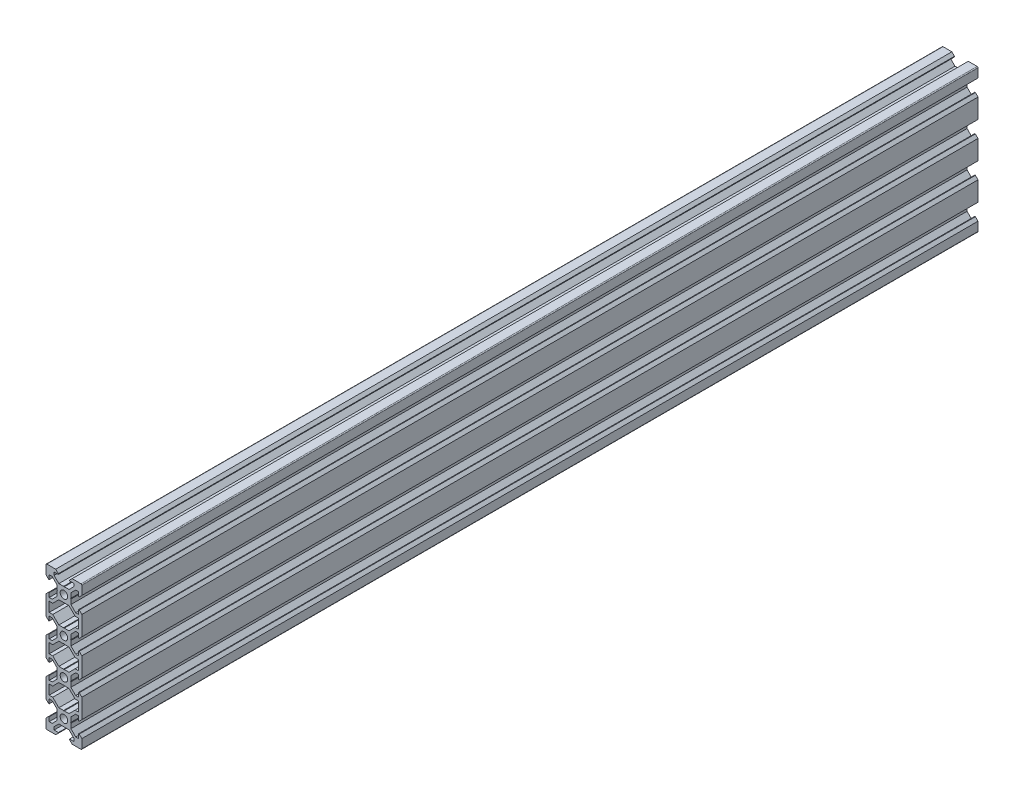
from build123d import *

# Parameters (mm, degrees)
BOSS_EXTRU_1_DEPTH = 500


with BuildPart() as part:
    # Esquisse1 → Boss.-Extru.1 (new body)
    with BuildSketch(Plane.XY):
        with BuildLine():
            Line((-9.5, 10), (-4.58, 10))
            Line((-4.58, 10), (-3.125, 8.545))
            Line((-3.125, 8.545), (-3.125, 8.2))
            Line((-3.125, 8.2), (-5.5, 8.2))
            Line((-5.5, 8.2), (-5.5, 6.560660172))
            Line((-5.5, 6.560660172), (-2.839339828, 3.9))
            Line((-2.839339828, 3.9), (-0.21, 3.9))
            Line((-0.21, 3.9), (0, 3.69))
            Line((0, 3.69), (0, 2.1))
            ThreePointArc((0, 2.1), (-2.1, 0), (0, -2.1))
            Line((0, -2.1), (0, -3.69))
            Line((0, -3.69), (-0.21, -3.9))
            Line((-0.21, -3.9), (-2.839339828, -3.9))
            Line((-2.839339828, -3.9), (-6.239339828, -7.3))
            Line((-6.239339828, -7.3), (-8.2, -7.3))
            Line((-8.2, -7.3), (-8.2, -12.7))
            Line((-8.2, -12.7), (-6.239339828, -12.7))
            Line((-6.239339828, -12.7), (-2.839339828, -16.1))
            Line((-2.839339828, -16.1), (-0.21, -16.1))
            Line((-0.21, -16.1), (0, -16.31))
            Line((0, -16.31), (0, -17.9))
            ThreePointArc((0, -17.9), (-2.1, -20), (0, -22.1))
            Line((0, -22.1), (0, -23.69))
            Line((0, -23.69), (-0.21, -23.9))
            Line((-0.21, -23.9), (-2.839339828, -23.9))
            Line((-2.839339828, -23.9), (-6.239339828, -27.3))
            Line((-6.239339828, -27.3), (-8.2, -27.3))
            Line((-8.2, -27.3), (-8.2, -32.7))
            Line((-8.2, -32.7), (-6.239339828, -32.7))
            Line((-6.239339828, -32.7), (-2.839339828, -36.1))
            Line((-2.839339828, -36.1), (-0.21, -36.1))
            Line((-0.21, -36.1), (0, -36.31))
            Line((0, -36.31), (0, -37.9))
            ThreePointArc((0, -37.9), (-2.1, -40), (0, -42.1))
            Line((0, -42.1), (0, -43.69))
            Line((0, -43.69), (-0.21, -43.9))
            Line((-0.21, -43.9), (-2.839339828, -43.9))
            Line((-2.839339828, -43.9), (-6.239339828, -47.3))
            Line((-6.239339828, -47.3), (-8.2, -47.3))
            Line((-8.2, -47.3), (-8.2, -52.7))
            Line((-8.2, -52.7), (-6.239339828, -52.7))
            Line((-6.239339828, -52.7), (-2.839339828, -56.1))
            Line((-2.839339828, -56.1), (-0.21, -56.1))
            Line((-0.21, -56.1), (0, -56.31))
            Line((0, -56.31), (0, -57.9))
            ThreePointArc((0, -57.9), (-2.1, -60), (0, -62.1))
            Line((0, -62.1), (0, -63.69))
            Line((0, -63.69), (-0.21, -63.9))
            Line((-0.21, -63.9), (-2.839339828, -63.9))
            Line((-2.839339828, -63.9), (-5.5, -66.560660172))
            Line((-5.5, -66.560660172), (-5.5, -68.2))
            Line((-5.5, -68.2), (-3.125, -68.2))
            Line((-3.125, -68.2), (-3.125, -68.545))
            Line((-3.125, -68.545), (-4.58, -70))
            Line((-4.58, -70), (-9.5, -70))
            ThreePointArc((-9.5, -70), (-9.853553391, -69.853553391), (-10, -69.5))
            Line((-10, -69.5), (-10, -64.58))
            Line((-10, -64.58), (-8.545, -63.125))
            Line((-8.545, -63.125), (-8.2, -63.125))
            Line((-8.2, -63.125), (-8.2, -65.5))
            Line((-8.2, -65.5), (-6.560660172, -65.5))
            Line((-6.560660172, -65.5), (-3.9, -62.839339828))
            Line((-3.9, -62.839339828), (-3.9, -60.21))
            Line((-3.9, -60.21), (-3.69, -60))
            Line((-3.69, -60), (-3.9, -59.79))
            Line((-3.9, -59.79), (-3.9, -57.160660172))
            Line((-3.9, -57.160660172), (-6.560660172, -54.5))
            Line((-6.560660172, -54.5), (-8.2, -54.5))
            Line((-8.2, -54.5), (-8.2, -56.875))
            Line((-8.2, -56.875), (-8.545, -56.875))
            Line((-8.545, -56.875), (-10, -55.42))
            Line((-10, -55.42), (-10, -44.58))
            Line((-10, -44.58), (-8.545, -43.125))
            Line((-8.545, -43.125), (-8.2, -43.125))
            Line((-8.2, -43.125), (-8.2, -45.5))
            Line((-8.2, -45.5), (-6.560660172, -45.5))
            Line((-6.560660172, -45.5), (-3.9, -42.839339828))
            Line((-3.9, -42.839339828), (-3.9, -40.21))
            Line((-3.9, -40.21), (-3.69, -40))
            Line((-3.69, -40), (-3.9, -39.79))
            Line((-3.9, -39.79), (-3.9, -37.160660172))
            Line((-3.9, -37.160660172), (-6.560660172, -34.5))
            Line((-6.560660172, -34.5), (-8.2, -34.5))
            Line((-8.2, -34.5), (-8.2, -36.875))
            Line((-8.2, -36.875), (-8.545, -36.875))
            Line((-8.545, -36.875), (-10, -35.42))
            Line((-10, -35.42), (-10, -24.58))
            Line((-10, -24.58), (-8.545, -23.125))
            Line((-8.545, -23.125), (-8.2, -23.125))
            Line((-8.2, -23.125), (-8.2, -25.5))
            Line((-8.2, -25.5), (-6.560660172, -25.5))
            Line((-6.560660172, -25.5), (-3.9, -22.839339828))
            Line((-3.9, -22.839339828), (-3.9, -20.21))
            Line((-3.9, -20.21), (-3.69, -20))
            Line((-3.69, -20), (-3.9, -19.79))
            Line((-3.9, -19.79), (-3.9, -17.160660172))
            Line((-3.9, -17.160660172), (-6.560660172, -14.5))
            Line((-6.560660172, -14.5), (-8.2, -14.5))
            Line((-8.2, -14.5), (-8.2, -16.875))
            Line((-8.2, -16.875), (-8.545, -16.875))
            Line((-8.545, -16.875), (-10, -15.42))
            Line((-10, -15.42), (-10, -4.58))
            Line((-10, -4.58), (-8.545, -3.125))
            Line((-8.545, -3.125), (-8.2, -3.125))
            Line((-8.2, -3.125), (-8.2, -5.5))
            Line((-8.2, -5.5), (-6.560660172, -5.5))
            Line((-6.560660172, -5.5), (-3.9, -2.839339828))
            Line((-3.9, -2.839339828), (-3.9, -0.21))
            Line((-3.9, -0.21), (-3.69, 0))
            Line((-3.69, 0), (-3.9, 0.21))
            Line((-3.9, 0.21), (-3.9, 2.839339828))
            Line((-3.9, 2.839339828), (-6.560660172, 5.5))
            Line((-6.560660172, 5.5), (-8.2, 5.5))
            Line((-8.2, 5.5), (-8.2, 3.125))
            Line((-8.2, 3.125), (-8.545, 3.125))
            Line((-8.545, 3.125), (-10, 4.58))
            Line((-10, 4.58), (-10, 9.5))
            ThreePointArc((-10, 9.5), (-9.853553391, 9.853553391), (-9.5, 10))
        make_face()
    boss_extru_1 = extrude(amount=BOSS_EXTRU_1_DEPTH)

    # Symétrie1: Boss.-Extru.1 across plane
    add(boss_extru_1.mirror(Plane(origin=(0, 3.69, 500), x_dir=(0, 0, 1), z_dir=(-1, 0, 0))))


solid = part.part
